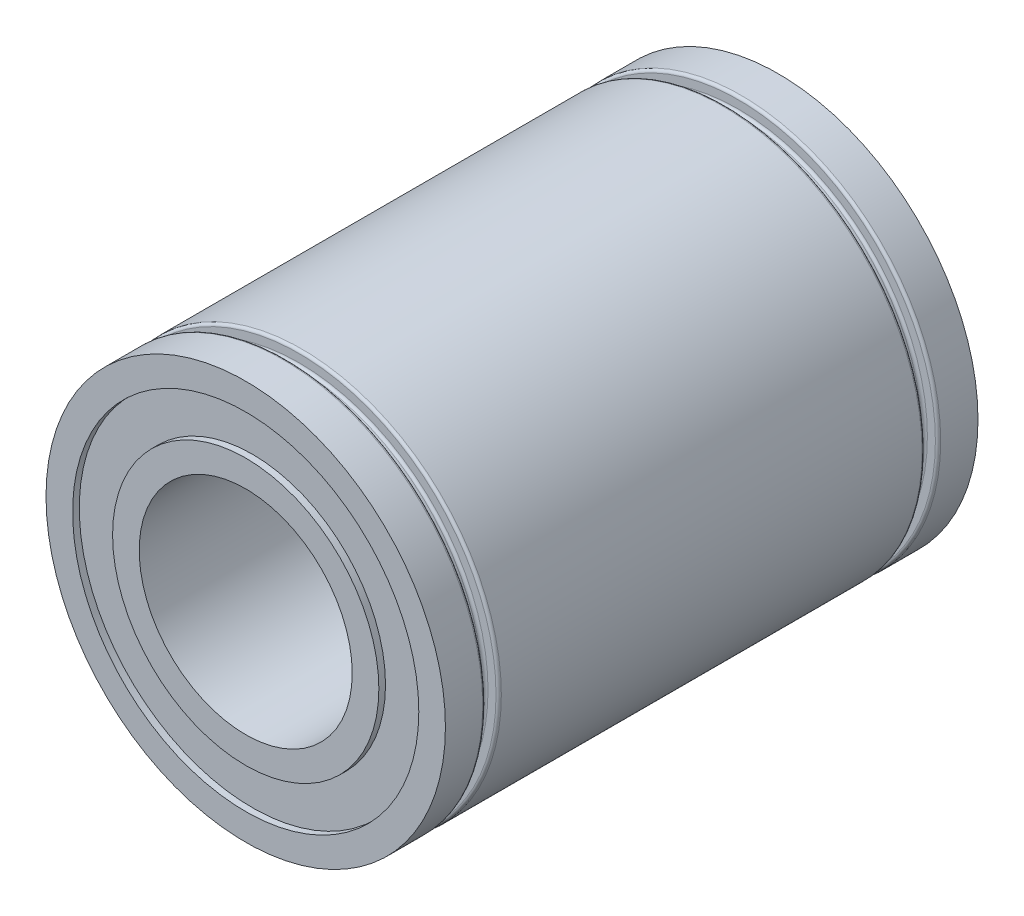
from build123d import *

# Parameters (mm, degrees)
SKETCH2_R             = 5
SKETCH2_R_2           = 4
BOSS_EXTRUDE1_DEPTH   = 10
SKETCH2_R_3           = 7.5
SKETCH2_R_4           = 6.5
BOSS_EXTRUDE1_2_DEPTH = 10
SKETCH2_3_R           = 6.5
SKETCH2_3_R_2         = 5
BOSS_EXTRUDE2_DEPTH   = 9.75
SKETCH3_W             = 1
SKETCH3_H             = 0.5
FILLET1_R             = 0.1


with BuildPart() as part:
    # Sketch2 → Boss-Extrude1 (new, symmetric)
    with BuildSketch(Plane.XY):
        Circle(SKETCH2_R)
        Circle(SKETCH2_R_2, mode=Mode.SUBTRACT)
    extrude(amount=BOSS_EXTRUDE1_DEPTH, both=True)



with BuildPart() as body_2:
    # Sketch2 → Boss-Extrude1 2 (new, symmetric)
    with BuildSketch(Plane.XY):
        Circle(SKETCH2_R_3)
        Circle(SKETCH2_R_4, mode=Mode.SUBTRACT)
    extrude(amount=BOSS_EXTRUDE1_2_DEPTH, both=True)


with BuildPart() as part_1:
    add(part.part)

    add(body_2.part)  # Boss-Extrude2 merges body 2
    # Sketch2<3> → Boss-Extrude2 (add, symmetric)
    with BuildSketch(Plane.XY):
        Circle(SKETCH2_3_R)
        Circle(SKETCH2_3_R_2, mode=Mode.SUBTRACT)
    extrude(amount=BOSS_EXTRUDE2_DEPTH, both=True)

    # Sketch3 → Cut-Revolve1 (revolve, cut)
    with BuildSketch(Plane(origin=(0, 0, 0), x_dir=(1, 0, 0), z_dir=(0, 1, 0)), mode=Mode.PRIVATE) as cut_revolve1_sk:
        with Locations((7.5, 8.25)):
            Rectangle(SKETCH3_W, SKETCH3_H)
        with Locations((7.5, -8.25)):
            Rectangle(SKETCH3_W, SKETCH3_H)
    revolve(cut_revolve1_sk.sketch.rotate(Axis((0, 0, -10), (0, 0, 1)), 180), axis=Axis((0, 0, -10), (0, 0, 1)), mode=Mode.SUBTRACT)

    # Fillet1
    fillet1_edges = [part_1.edges().sort_by_distance(p)[0] for p in [
        (7, 0, -8),
        (-7.5, 0, -8.5),
        (7, 0, -8.5),
        (-7.5, 0, -8),
        (7, 0, 8.5),
        (7, 0, 8),
        (-7.5, 0, 8),
        (-7.5, 0, 8.5),
    ]]
    fillet(fillet1_edges, radius=FILLET1_R)


solid = part_1.part
